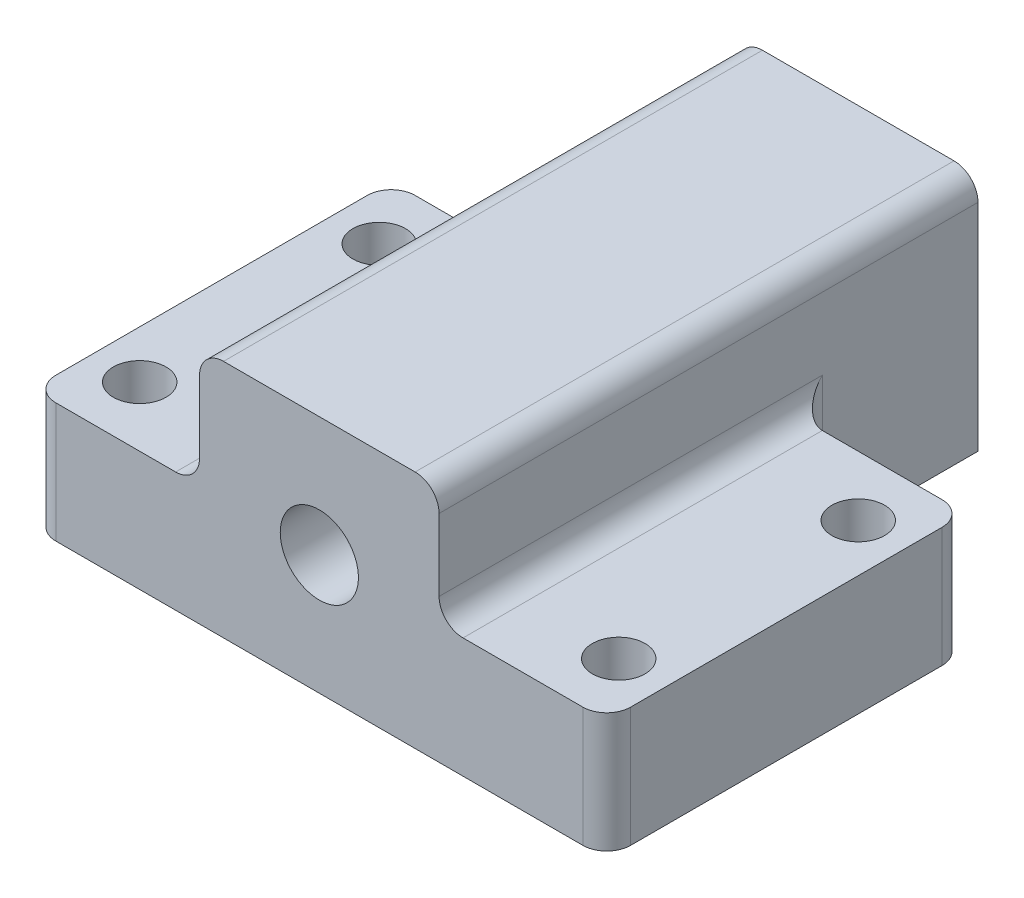
from build123d import *

# Parameters (mm, degrees)
SKETCH1_W                       = 48
SKETCH1_H                       = 30
SKETCH1_R                       = 2.2
BOSS_EXTRUDE1_DEPTH             = 10
BOSS_EXTRUDE2_REACH             = 41.699
SKETCH3_W                       = 20
SKETCH3_H                       = 20
BOSS_EXTRUDE2_DIRECTION_2_DEPTH = 15
CUT_EXTRUDE1_START              = -30
CUT_EXTRUDE1_DEPTH              = 30
SKETCH5_R                       = 3.2639
CUT_EXTRUDE2_DEPTH              = 44.312815655
FILLET2_R                       = 2


with BuildPart() as part:
    # Sketch1 → Boss-Extrude1 (new body)
    with BuildSketch(Plane(origin=(0, 0, 0), x_dir=(1, 0, 0), z_dir=(0, 1, 0))):
        Rectangle(SKETCH1_W, SKETCH1_H)
        with Locations(Location((-20, 10, 0), (0, 0, 270))):
            Circle(SKETCH1_R, mode=Mode.SUBTRACT)
        with Locations(Location((20, 10, 0), (0, 0, 270))):
            Circle(SKETCH1_R, mode=Mode.SUBTRACT)
        with Locations(Location((20, -10, 0), (0, 0, 270))):
            Circle(SKETCH1_R, mode=Mode.SUBTRACT)
        with Locations(Location((-20, -10, 0), (0, 0, 270))):
            Circle(SKETCH1_R, mode=Mode.SUBTRACT)
    extrude(amount=BOSS_EXTRUDE1_DEPTH)

    # Boss-Extrude2: up to this face of the body (flat: up to its plane)
    boss_extrude2_end = Plane(part.part.faces().sort_by_distance((0, 5, 15))[0])
    # Sketch3 → Boss-Extrude2 (add, up to the picked face)
    with BuildSketch(Plane(origin=(0, 0, -15), x_dir=(-1, 0, 0), z_dir=(0, 0, -1)), mode=Mode.PRIVATE) as boss_extrude2_sk1:
        with Locations((0, 10)):
            Rectangle(SKETCH3_W, SKETCH3_H)
    boss_extrude2_tool1 = split(extrude(boss_extrude2_sk1.sketch, amount=-BOSS_EXTRUDE2_REACH, mode=Mode.PRIVATE), bisect_by=boss_extrude2_end, keep=Keep.BOTH, mode=Mode.PRIVATE)
    add(boss_extrude2_tool1.solids().sort_by(Axis((0, 10, -15), (0, 0, 1)))[0])

    # Sketch3 → Boss-Extrude2 direction 2 (add)
    with BuildSketch(Plane(origin=(0, 0, -15), x_dir=(-1, 0, 0), z_dir=(0, 0, -1))):
        with Locations((0, 10)):
            Rectangle(SKETCH3_W, SKETCH3_H)
    extrude(amount=BOSS_EXTRUDE2_DIRECTION_2_DEPTH)

    # Sketch4 → Cut-Extrude1 (cut)
    with BuildSketch(Plane(origin=(0, 0, -30), x_dir=(-1, 0, 0), z_dir=(0, 0, -1)).offset(CUT_EXTRUDE1_START)):
        Polygon((-6.5, 13.75277675), (-6.5, 6.24722325), (0, 2.494446501), (6.5, 6.24722325), (6.5, 13.75277675), (0, 17.505553499), align=None)
    extrude(amount=CUT_EXTRUDE1_DEPTH, mode=Mode.SUBTRACT)

    # Sketch5 → Cut-Extrude2 (cut, through all)
    with BuildSketch(Plane(origin=(0, 0, -15), x_dir=(-1, 0, 0), z_dir=(0, 0, -1))):
        with Locations((0, 10)):
            Circle(SKETCH5_R)
    extrude(amount=-CUT_EXTRUDE2_DEPTH, mode=Mode.SUBTRACT)

    # Fillet2
    fillet2_edges = [part.edges().sort_by_distance(p)[0] for p in [
        (-10, 5, -15),
        (10, 5, -15),
        (10, 10, 0),
        (10, 20, -7.5),
        (-10, 10, 0),
        (-10, 20, -7.5),
        (-24, 5, -15),
        (24, 5, -15),
        (24, 5, 15),
        (-24, 5, 15),
    ]]
    fillet(fillet2_edges, radius=FILLET2_R)


solid = part.part
